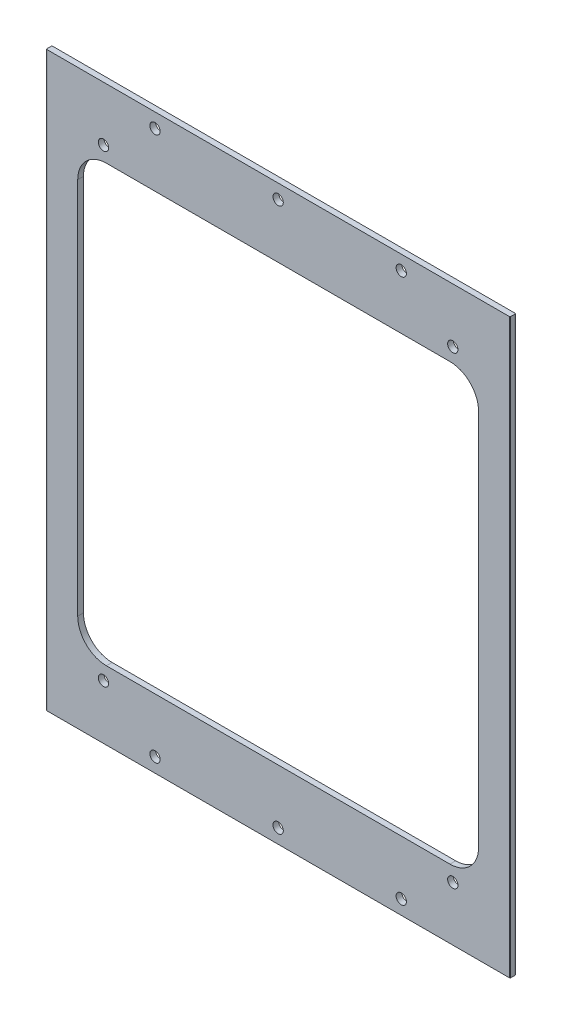
from build123d import *

# Parameters (mm, degrees)
SKETCH1_W                   = 81
SKETCH1_H                   = 100
BOSS_EXTRUDE1_DEPTH         = 0.5
CUT_EXTRUDE1_DEPTH          = 65.352544627
M1_6_HOLE1_PCBUNION_D       = 1.8
M1_6_HOLE1_PCBUNION_DEPTH   = 100
M1_6_HOLE1_PCBUNION_TIP     = 0.540774557
M1_6_HOLE2_PLATEUNION_D     = 1.8
M1_6_HOLE2_PLATEUNION_DEPTH = 100
M1_6_HOLE2_PLATEUNION_TIP   = 0.540774557
M1_6_HOLE3_TOPUNION_D       = 1.8
M1_6_HOLE3_TOPUNION_DEPTH   = 200
M1_6_HOLE3_TOPUNION_TIP     = 0.540774557
FILLET1_R                   = 0.1


with BuildPart() as part:
    # Sketch1 → Boss-Extrude1 (new, symmetric)
    with BuildSketch(Plane.XY):
        Rectangle(SKETCH1_W, SKETCH1_H)
    extrude(amount=BOSS_EXTRUDE1_DEPTH, both=True)

    # Sketch2 → Cut-Extrude1 (cut, through all)
    with BuildSketch(Plane.XY.offset(0.5)):
        with BuildLine():
            Line((-30, -38), (30, -38))
            ThreePointArc((30, -38), (33.535533906, -36.535533906), (35, -33))
            Line((35, -33), (35, 33))
            ThreePointArc((35, 33), (33.535533906, 36.535533906), (30, 38))
            Line((30, 38), (-30, 38))
            ThreePointArc((-30, 38), (-33.535533906, 36.535533906), (-35, 33))
            Line((-35, 33), (-35, -33))
            ThreePointArc((-35, -33), (-33.535533906, -36.535533906), (-30, -38))
        make_face()
    extrude(amount=-CUT_EXTRUDE1_DEPTH, mode=Mode.SUBTRACT)

    # M1.6 Hole1-PCBUnion
    with Locations(Plane.XY.offset(0.5)):
        with Locations((-30.5, 40.5), (30.5, 40.5), (-30.5, -40.5), (30.5, -40.5)):
            Hole(M1_6_HOLE1_PCBUNION_D / 2, depth=M1_6_HOLE1_PCBUNION_DEPTH)
            with Locations((0, 0, -(M1_6_HOLE1_PCBUNION_DEPTH + M1_6_HOLE1_PCBUNION_TIP / 2))):  # 118° drill point
                Cone(0, M1_6_HOLE1_PCBUNION_D / 2, M1_6_HOLE1_PCBUNION_TIP, mode=Mode.SUBTRACT)

    # M1.6 Hole2-PlateUnion
    with Locations(Plane.XY.offset(0.5)):
        with Locations((-21.5, 47.5), (21.5, 47.5), (-21.5, -47.5), (21.5, -47.5)):
            Hole(M1_6_HOLE2_PLATEUNION_D / 2, depth=M1_6_HOLE2_PLATEUNION_DEPTH)
            with Locations((0, 0, -(M1_6_HOLE2_PLATEUNION_DEPTH + M1_6_HOLE2_PLATEUNION_TIP / 2))):  # 118° drill point
                Cone(0, M1_6_HOLE2_PLATEUNION_D / 2, M1_6_HOLE2_PLATEUNION_TIP, mode=Mode.SUBTRACT)

    # M1.6 Hole3-TopUnion
    with Locations(Plane.XY.offset(0.5)):
        with Locations((0, 47.5), (0, -47.5)):
            Hole(M1_6_HOLE3_TOPUNION_D / 2, depth=M1_6_HOLE3_TOPUNION_DEPTH)
            with Locations((0, 0, -(M1_6_HOLE3_TOPUNION_DEPTH + M1_6_HOLE3_TOPUNION_TIP / 2))):  # 118° drill point
                Cone(0, M1_6_HOLE3_TOPUNION_D / 2, M1_6_HOLE3_TOPUNION_TIP, mode=Mode.SUBTRACT)

    # Fillet1
    fillet1_edges = [part.edges().sort_by_distance(p)[0] for p in [
        (-40.5, 0, 0.5),
        (40.5, 0, 0.5),
        (-40.5, 0, -0.5),
        (40.5, 0, -0.5),
    ]]
    fillet(fillet1_edges, radius=FILLET1_R)


solid = part.part
